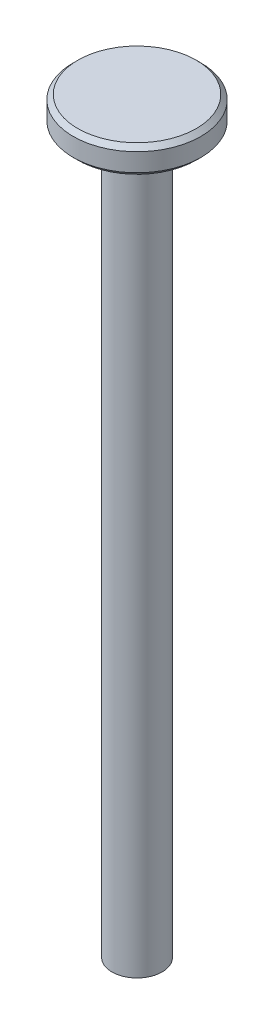
from build123d import *


with BuildPart() as part:
    # Sketch2 → Revolve1 (revolve)
    with BuildSketch(Plane.XY):
        Polygon((0, 0), (0, 79), (6.5, 79), (7, 78.5), (7, 76.5), (6.5, 76), (2.75, 76), (2.75, -3), (1.75, -3), (1.75, 0), align=None)
    revolve(axis=Axis((0, -28.504565853, 0), (0, 1, 0)))


solid = part.part
